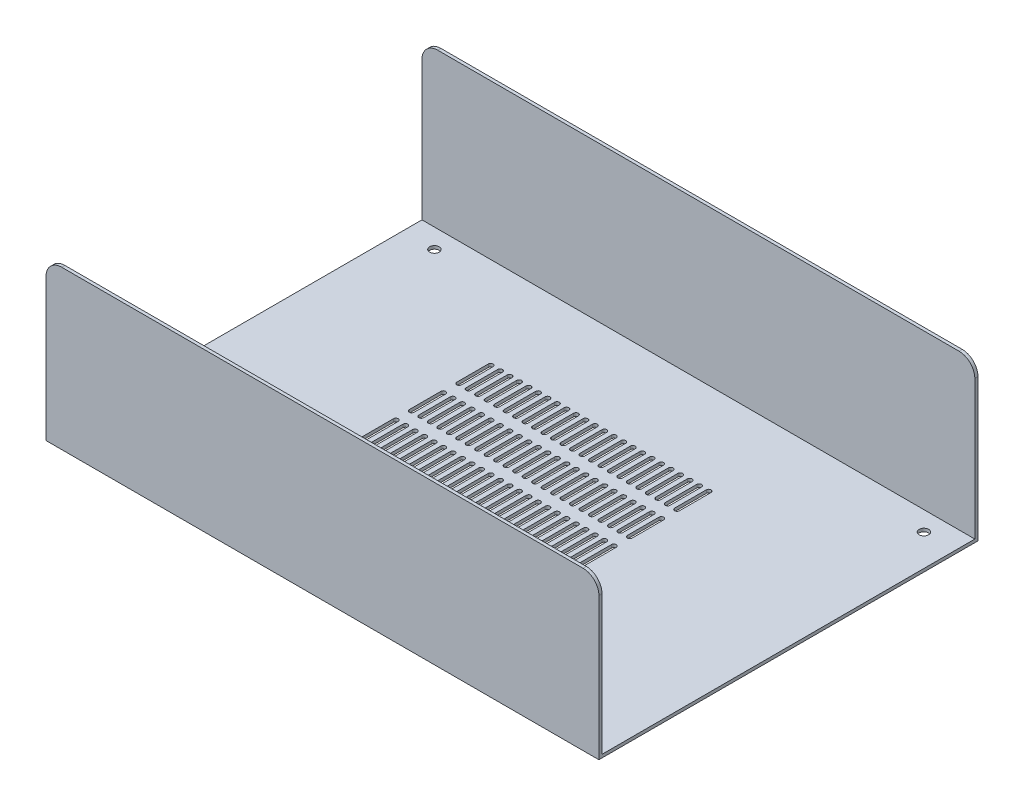
from build123d import *

# Parameters (mm, degrees)
SKETCH1_W          = 175
SKETCH1_H          = 120
EXTRUDE1_DEPTH     = 1
EXTRUDE2_DEPTH     = 1
SKETCH3_R          = 1.5
CUT_EXTRUDE1_DEPTH = 118.287041057
EXTRUDE3_DEPTH     = 1


with BuildPart() as part:
    # Sketch1 → Extrude1 (new body)
    with BuildSketch(Plane(origin=(0, 0, 0), x_dir=(1, 0, 0), z_dir=(0, 1, 0))):
        Rectangle(SKETCH1_W, SKETCH1_H)
    extrude(amount=EXTRUDE1_DEPTH)

    # Sketch2 → Extrude2 (add)
    with BuildSketch(Plane.XY.offset(60)):
        with BuildLine():
            Line((-82.5, 50), (82.5, 50))
            ThreePointArc((82.5, 50), (86.035533906, 48.535533906), (87.5, 45))
            Line((87.5, 45), (87.5, 1))
            Line((87.5, 1), (-87.5, 1))
            Line((-87.5, 1), (-87.5, 45))
            ThreePointArc((-87.5, 45), (-86.035533906, 48.535533906), (-82.5, 50))
        make_face()
    extrude2 = extrude(amount=-EXTRUDE2_DEPTH)

    # Mirror1: Extrude2 across plane
    add(extrude2.mirror(Plane.XY))

    # Sketch3 → Cut-Extrude1 (cut, through all)
    with BuildSketch(Plane.XZ):
        with Locations(Location((-77.42, 51.92, 0), (0, 0, 270))):
            Circle(SKETCH3_R)
        with Locations(Location((77.52, 51.92, 0), (0, 0, 270))):
            Circle(SKETCH3_R)
        with Locations(Location((77.52, -52.86, 0), (0, 0, 270))):
            Circle(SKETCH3_R)
        with Locations(Location((-77.42, -52.86, 0), (0, 0, 270))):
            Circle(SKETCH3_R)
    extrude(amount=-CUT_EXTRUDE1_DEPTH, mode=Mode.SUBTRACT)

    # Sketch4 → Extrude3 (cut)
    with BuildSketch(Plane.XZ):
        with BuildLine():
            Line((-37.5, 10), (-37.5, 0))
            ThreePointArc((-37.5, 0), (-36.75, -0.75), (-36, 0))
            Line((-36, 0), (-36, 10))
            ThreePointArc((-36, 10), (-36.75, 10.75), (-37.5, 10))
        make_face()
        with BuildLine():
            Line((-34.5, 10), (-34.5, 0))
            ThreePointArc((-34.5, 0), (-33.75, -0.75), (-33, 0))
            Line((-33, 0), (-33, 10))
            ThreePointArc((-33, 10), (-33.75, 10.75), (-34.5, 10))
        make_face()
        with BuildLine():
            Line((-31.5, 10), (-31.5, 0))
            ThreePointArc((-31.5, 0), (-30.75, -0.75), (-30, 0))
            Line((-30, 0), (-30, 10))
            ThreePointArc((-30, 10), (-30.75, 10.75), (-31.5, 10))
        make_face()
        with BuildLine():
            Line((-28.5, 10), (-28.5, 0))
            ThreePointArc((-28.5, 0), (-27.75, -0.75), (-27, 0))
            Line((-27, 0), (-27, 10))
            ThreePointArc((-27, 10), (-27.75, 10.75), (-28.5, 10))
        make_face()
        with BuildLine():
            Line((-25.5, 10), (-25.5, 0))
            ThreePointArc((-25.5, 0), (-24.75, -0.75), (-24, 0))
            Line((-24, 0), (-24, 10))
            ThreePointArc((-24, 10), (-24.75, 10.75), (-25.5, 10))
        make_face()
        with BuildLine():
            Line((-22.5, 10), (-22.5, 0))
            ThreePointArc((-22.5, 0), (-21.75, -0.75), (-21, 0))
            Line((-21, 0), (-21, 10))
            ThreePointArc((-21, 10), (-21.75, 10.75), (-22.5, 10))
        make_face()
        with BuildLine():
            Line((-19.5, 10), (-19.5, 0))
            ThreePointArc((-19.5, 0), (-18.75, -0.75), (-18, 0))
            Line((-18, 0), (-18, 10))
            ThreePointArc((-18, 10), (-18.75, 10.75), (-19.5, 10))
        make_face()
        with BuildLine():
            Line((-16.5, 10), (-16.5, 0))
            ThreePointArc((-16.5, 0), (-15.75, -0.75), (-15, 0))
            Line((-15, 0), (-15, 10))
            ThreePointArc((-15, 10), (-15.75, 10.75), (-16.5, 10))
        make_face()
        with BuildLine():
            Line((-13.5, 10), (-13.5, 0))
            ThreePointArc((-13.5, 0), (-12.75, -0.75), (-12, 0))
            Line((-12, 0), (-12, 10))
            ThreePointArc((-12, 10), (-12.75, 10.75), (-13.5, 10))
        make_face()
        with BuildLine():
            Line((-10.5, 10), (-10.5, 0))
            ThreePointArc((-10.5, 0), (-9.75, -0.75), (-9, 0))
            Line((-9, 0), (-9, 10))
            ThreePointArc((-9, 10), (-9.75, 10.75), (-10.5, 10))
        make_face()
        with BuildLine():
            Line((-7.5, 10), (-7.5, 0))
            ThreePointArc((-7.5, 0), (-6.75, -0.75), (-6, 0))
            Line((-6, 0), (-6, 10))
            ThreePointArc((-6, 10), (-6.75, 10.75), (-7.5, 10))
        make_face()
        with BuildLine():
            Line((-4.5, 10), (-4.5, 0))
            ThreePointArc((-4.5, 0), (-3.75, -0.75), (-3, 0))
            Line((-3, 0), (-3, 10))
            ThreePointArc((-3, 10), (-3.75, 10.75), (-4.5, 10))
        make_face()
        with BuildLine():
            Line((-1.5, 10), (-1.5, 0))
            ThreePointArc((-1.5, 0), (-0.75, -0.75), (0, 0))
            Line((0, 0), (0, 10))
            ThreePointArc((0, 10), (-0.75, 10.75), (-1.5, 10))
        make_face()
        with BuildLine():
            Line((1.5, 10), (1.5, 0))
            ThreePointArc((1.5, 0), (2.25, -0.75), (3, 0))
            Line((3, 0), (3, 10))
            ThreePointArc((3, 10), (2.25, 10.75), (1.5, 10))
        make_face()
        with BuildLine():
            Line((4.5, 10), (4.5, 0))
            ThreePointArc((4.5, 0), (5.25, -0.75), (6, 0))
            Line((6, 0), (6, 10))
            ThreePointArc((6, 10), (5.25, 10.75), (4.5, 10))
        make_face()
        with BuildLine():
            Line((7.5, 10), (7.5, 0))
            ThreePointArc((7.5, 0), (8.25, -0.75), (9, 0))
            Line((9, 0), (9, 10))
            ThreePointArc((9, 10), (8.25, 10.75), (7.5, 10))
        make_face()
        with BuildLine():
            Line((10.5, 10), (10.5, 0))
            ThreePointArc((10.5, 0), (11.25, -0.75), (12, 0))
            Line((12, 0), (12, 10))
            ThreePointArc((12, 10), (11.25, 10.75), (10.5, 10))
        make_face()
        with BuildLine():
            Line((13.5, 10), (13.5, 0))
            ThreePointArc((13.5, 0), (14.25, -0.75), (15, 0))
            Line((15, 0), (15, 10))
            ThreePointArc((15, 10), (14.25, 10.75), (13.5, 10))
        make_face()
        with BuildLine():
            Line((16.5, 10), (16.5, 0))
            ThreePointArc((16.5, 0), (17.25, -0.75), (18, 0))
            Line((18, 0), (18, 10))
            ThreePointArc((18, 10), (17.25, 10.75), (16.5, 10))
        make_face()
        with BuildLine():
            Line((19.5, 10), (19.5, 0))
            ThreePointArc((19.5, 0), (20.25, -0.75), (21, 0))
            Line((21, 0), (21, 10))
            ThreePointArc((21, 10), (20.25, 10.75), (19.5, 10))
        make_face()
        with BuildLine():
            Line((22.5, 10), (22.5, 0))
            ThreePointArc((22.5, 0), (23.25, -0.75), (24, 0))
            Line((24, 0), (24, 10))
            ThreePointArc((24, 10), (23.25, 10.75), (22.5, 10))
        make_face()
        with BuildLine():
            Line((25.5, 10), (25.5, 0))
            ThreePointArc((25.5, 0), (26.25, -0.75), (27, 0))
            Line((27, 0), (27, 10))
            ThreePointArc((27, 10), (26.25, 10.75), (25.5, 10))
        make_face()
        with BuildLine():
            Line((28.5, 10), (28.5, 0))
            ThreePointArc((28.5, 0), (29.25, -0.75), (30, 0))
            Line((30, 0), (30, 10))
            ThreePointArc((30, 10), (29.25, 10.75), (28.5, 10))
        make_face()
        with BuildLine():
            Line((31.5, 10), (31.5, 0))
            ThreePointArc((31.5, 0), (32.25, -0.75), (33, 0))
            Line((33, 0), (33, 10))
            ThreePointArc((33, 10), (32.25, 10.75), (31.5, 10))
        make_face()
        with BuildLine():
            Line((-37.5, -5), (-37.5, -15))
            ThreePointArc((-37.5, -15), (-36.75, -15.75), (-36, -15))
            Line((-36, -15), (-36, -5))
            ThreePointArc((-36, -5), (-36.75, -4.25), (-37.5, -5))
        make_face()
        with BuildLine():
            Line((-34.5, -5), (-34.5, -15))
            ThreePointArc((-34.5, -15), (-33.75, -15.75), (-33, -15))
            Line((-33, -15), (-33, -5))
            ThreePointArc((-33, -5), (-33.75, -4.25), (-34.5, -5))
        make_face()
        with BuildLine():
            Line((-31.5, -5), (-31.5, -15))
            ThreePointArc((-31.5, -15), (-30.75, -15.75), (-30, -15))
            Line((-30, -15), (-30, -5))
            ThreePointArc((-30, -5), (-30.75, -4.25), (-31.5, -5))
        make_face()
        with BuildLine():
            Line((-28.5, -5), (-28.5, -15))
            ThreePointArc((-28.5, -15), (-27.75, -15.75), (-27, -15))
            Line((-27, -15), (-27, -5))
            ThreePointArc((-27, -5), (-27.75, -4.25), (-28.5, -5))
        make_face()
        with BuildLine():
            Line((-25.5, -5), (-25.5, -15))
            ThreePointArc((-25.5, -15), (-24.75, -15.75), (-24, -15))
            Line((-24, -15), (-24, -5))
            ThreePointArc((-24, -5), (-24.75, -4.25), (-25.5, -5))
        make_face()
        with BuildLine():
            Line((-22.5, -5), (-22.5, -15))
            ThreePointArc((-22.5, -15), (-21.75, -15.75), (-21, -15))
            Line((-21, -15), (-21, -5))
            ThreePointArc((-21, -5), (-21.75, -4.25), (-22.5, -5))
        make_face()
        with BuildLine():
            Line((-19.5, -5), (-19.5, -15))
            ThreePointArc((-19.5, -15), (-18.75, -15.75), (-18, -15))
            Line((-18, -15), (-18, -5))
            ThreePointArc((-18, -5), (-18.75, -4.25), (-19.5, -5))
        make_face()
        with BuildLine():
            Line((-16.5, -5), (-16.5, -15))
            ThreePointArc((-16.5, -15), (-15.75, -15.75), (-15, -15))
            Line((-15, -15), (-15, -5))
            ThreePointArc((-15, -5), (-15.75, -4.25), (-16.5, -5))
        make_face()
        with BuildLine():
            Line((-13.5, -5), (-13.5, -15))
            ThreePointArc((-13.5, -15), (-12.75, -15.75), (-12, -15))
            Line((-12, -15), (-12, -5))
            ThreePointArc((-12, -5), (-12.75, -4.25), (-13.5, -5))
        make_face()
        with BuildLine():
            Line((-10.5, -5), (-10.5, -15))
            ThreePointArc((-10.5, -15), (-9.75, -15.75), (-9, -15))
            Line((-9, -15), (-9, -5))
            ThreePointArc((-9, -5), (-9.75, -4.25), (-10.5, -5))
        make_face()
        with BuildLine():
            Line((-7.5, -5), (-7.5, -15))
            ThreePointArc((-7.5, -15), (-6.75, -15.75), (-6, -15))
            Line((-6, -15), (-6, -5))
            ThreePointArc((-6, -5), (-6.75, -4.25), (-7.5, -5))
        make_face()
        with BuildLine():
            Line((-4.5, -5), (-4.5, -15))
            ThreePointArc((-4.5, -15), (-3.75, -15.75), (-3, -15))
            Line((-3, -15), (-3, -5))
            ThreePointArc((-3, -5), (-3.75, -4.25), (-4.5, -5))
        make_face()
        with BuildLine():
            Line((-1.5, -5), (-1.5, -15))
            ThreePointArc((-1.5, -15), (-0.75, -15.75), (0, -15))
            Line((0, -15), (0, -5))
            ThreePointArc((0, -5), (-0.75, -4.25), (-1.5, -5))
        make_face()
        with BuildLine():
            Line((1.5, -5), (1.5, -15))
            ThreePointArc((1.5, -15), (2.25, -15.75), (3, -15))
            Line((3, -15), (3, -5))
            ThreePointArc((3, -5), (2.25, -4.25), (1.5, -5))
        make_face()
        with BuildLine():
            Line((4.5, -5), (4.5, -15))
            ThreePointArc((4.5, -15), (5.25, -15.75), (6, -15))
            Line((6, -15), (6, -5))
            ThreePointArc((6, -5), (5.25, -4.25), (4.5, -5))
        make_face()
        with BuildLine():
            Line((7.5, -5), (7.5, -15))
            ThreePointArc((7.5, -15), (8.25, -15.75), (9, -15))
            Line((9, -15), (9, -5))
            ThreePointArc((9, -5), (8.25, -4.25), (7.5, -5))
        make_face()
        with BuildLine():
            Line((10.5, -5), (10.5, -15))
            ThreePointArc((10.5, -15), (11.25, -15.75), (12, -15))
            Line((12, -15), (12, -5))
            ThreePointArc((12, -5), (11.25, -4.25), (10.5, -5))
        make_face()
        with BuildLine():
            Line((13.5, -5), (13.5, -15))
            ThreePointArc((13.5, -15), (14.25, -15.75), (15, -15))
            Line((15, -15), (15, -5))
            ThreePointArc((15, -5), (14.25, -4.25), (13.5, -5))
        make_face()
        with BuildLine():
            Line((16.5, -5), (16.5, -15))
            ThreePointArc((16.5, -15), (17.25, -15.75), (18, -15))
            Line((18, -15), (18, -5))
            ThreePointArc((18, -5), (17.25, -4.25), (16.5, -5))
        make_face()
        with BuildLine():
            Line((19.5, -5), (19.5, -15))
            ThreePointArc((19.5, -15), (20.25, -15.75), (21, -15))
            Line((21, -15), (21, -5))
            ThreePointArc((21, -5), (20.25, -4.25), (19.5, -5))
        make_face()
        with BuildLine():
            Line((22.5, -5), (22.5, -15))
            ThreePointArc((22.5, -15), (23.25, -15.75), (24, -15))
            Line((24, -15), (24, -5))
            ThreePointArc((24, -5), (23.25, -4.25), (22.5, -5))
        make_face()
        with BuildLine():
            Line((25.5, -5), (25.5, -15))
            ThreePointArc((25.5, -15), (26.25, -15.75), (27, -15))
            Line((27, -15), (27, -5))
            ThreePointArc((27, -5), (26.25, -4.25), (25.5, -5))
        make_face()
        with BuildLine():
            Line((28.5, -5), (28.5, -15))
            ThreePointArc((28.5, -15), (29.25, -15.75), (30, -15))
            Line((30, -15), (30, -5))
            ThreePointArc((30, -5), (29.25, -4.25), (28.5, -5))
        make_face()
        with BuildLine():
            Line((31.5, -5), (31.5, -15))
            ThreePointArc((31.5, -15), (32.25, -15.75), (33, -15))
            Line((33, -15), (33, -5))
            ThreePointArc((33, -5), (32.25, -4.25), (31.5, -5))
        make_face()
        with BuildLine():
            Line((-37.5, -20), (-37.5, -30))
            ThreePointArc((-37.5, -30), (-36.75, -30.75), (-36, -30))
            Line((-36, -30), (-36, -20))
            ThreePointArc((-36, -20), (-36.75, -19.25), (-37.5, -20))
        make_face()
        with BuildLine():
            Line((-34.5, -20), (-34.5, -30))
            ThreePointArc((-34.5, -30), (-33.75, -30.75), (-33, -30))
            Line((-33, -30), (-33, -20))
            ThreePointArc((-33, -20), (-33.75, -19.25), (-34.5, -20))
        make_face()
        with BuildLine():
            Line((-31.5, -20), (-31.5, -30))
            ThreePointArc((-31.5, -30), (-30.75, -30.75), (-30, -30))
            Line((-30, -30), (-30, -20))
            ThreePointArc((-30, -20), (-30.75, -19.25), (-31.5, -20))
        make_face()
        with BuildLine():
            Line((-28.5, -20), (-28.5, -30))
            ThreePointArc((-28.5, -30), (-27.75, -30.75), (-27, -30))
            Line((-27, -30), (-27, -20))
            ThreePointArc((-27, -20), (-27.75, -19.25), (-28.5, -20))
        make_face()
        with BuildLine():
            Line((-25.5, -20), (-25.5, -30))
            ThreePointArc((-25.5, -30), (-24.75, -30.75), (-24, -30))
            Line((-24, -30), (-24, -20))
            ThreePointArc((-24, -20), (-24.75, -19.25), (-25.5, -20))
        make_face()
        with BuildLine():
            Line((-22.5, -20), (-22.5, -30))
            ThreePointArc((-22.5, -30), (-21.75, -30.75), (-21, -30))
            Line((-21, -30), (-21, -20))
            ThreePointArc((-21, -20), (-21.75, -19.25), (-22.5, -20))
        make_face()
        with BuildLine():
            Line((-19.5, -20), (-19.5, -30))
            ThreePointArc((-19.5, -30), (-18.75, -30.75), (-18, -30))
            Line((-18, -30), (-18, -20))
            ThreePointArc((-18, -20), (-18.75, -19.25), (-19.5, -20))
        make_face()
        with BuildLine():
            Line((-16.5, -20), (-16.5, -30))
            ThreePointArc((-16.5, -30), (-15.75, -30.75), (-15, -30))
            Line((-15, -30), (-15, -20))
            ThreePointArc((-15, -20), (-15.75, -19.25), (-16.5, -20))
        make_face()
        with BuildLine():
            Line((-13.5, -20), (-13.5, -30))
            ThreePointArc((-13.5, -30), (-12.75, -30.75), (-12, -30))
            Line((-12, -30), (-12, -20))
            ThreePointArc((-12, -20), (-12.75, -19.25), (-13.5, -20))
        make_face()
        with BuildLine():
            Line((-10.5, -20), (-10.5, -30))
            ThreePointArc((-10.5, -30), (-9.75, -30.75), (-9, -30))
            Line((-9, -30), (-9, -20))
            ThreePointArc((-9, -20), (-9.75, -19.25), (-10.5, -20))
        make_face()
        with BuildLine():
            Line((-7.5, -20), (-7.5, -30))
            ThreePointArc((-7.5, -30), (-6.75, -30.75), (-6, -30))
            Line((-6, -30), (-6, -20))
            ThreePointArc((-6, -20), (-6.75, -19.25), (-7.5, -20))
        make_face()
        with BuildLine():
            Line((-4.5, -20), (-4.5, -30))
            ThreePointArc((-4.5, -30), (-3.75, -30.75), (-3, -30))
            Line((-3, -30), (-3, -20))
            ThreePointArc((-3, -20), (-3.75, -19.25), (-4.5, -20))
        make_face()
        with BuildLine():
            Line((-1.5, -20), (-1.5, -30))
            ThreePointArc((-1.5, -30), (-0.75, -30.75), (0, -30))
            Line((0, -30), (0, -20))
            ThreePointArc((0, -20), (-0.75, -19.25), (-1.5, -20))
        make_face()
        with BuildLine():
            Line((1.5, -20), (1.5, -30))
            ThreePointArc((1.5, -30), (2.25, -30.75), (3, -30))
            Line((3, -30), (3, -20))
            ThreePointArc((3, -20), (2.25, -19.25), (1.5, -20))
        make_face()
        with BuildLine():
            Line((4.5, -20), (4.5, -30))
            ThreePointArc((4.5, -30), (5.25, -30.75), (6, -30))
            Line((6, -30), (6, -20))
            ThreePointArc((6, -20), (5.25, -19.25), (4.5, -20))
        make_face()
        with BuildLine():
            Line((7.5, -20), (7.5, -30))
            ThreePointArc((7.5, -30), (8.25, -30.75), (9, -30))
            Line((9, -30), (9, -20))
            ThreePointArc((9, -20), (8.25, -19.25), (7.5, -20))
        make_face()
        with BuildLine():
            Line((10.5, -20), (10.5, -30))
            ThreePointArc((10.5, -30), (11.25, -30.75), (12, -30))
            Line((12, -30), (12, -20))
            ThreePointArc((12, -20), (11.25, -19.25), (10.5, -20))
        make_face()
        with BuildLine():
            Line((13.5, -20), (13.5, -30))
            ThreePointArc((13.5, -30), (14.25, -30.75), (15, -30))
            Line((15, -30), (15, -20))
            ThreePointArc((15, -20), (14.25, -19.25), (13.5, -20))
        make_face()
        with BuildLine():
            Line((16.5, -20), (16.5, -30))
            ThreePointArc((16.5, -30), (17.25, -30.75), (18, -30))
            Line((18, -30), (18, -20))
            ThreePointArc((18, -20), (17.25, -19.25), (16.5, -20))
        make_face()
        with BuildLine():
            Line((19.5, -20), (19.5, -30))
            ThreePointArc((19.5, -30), (20.25, -30.75), (21, -30))
            Line((21, -30), (21, -20))
            ThreePointArc((21, -20), (20.25, -19.25), (19.5, -20))
        make_face()
        with BuildLine():
            Line((22.5, -20), (22.5, -30))
            ThreePointArc((22.5, -30), (23.25, -30.75), (24, -30))
            Line((24, -30), (24, -20))
            ThreePointArc((24, -20), (23.25, -19.25), (22.5, -20))
        make_face()
        with BuildLine():
            Line((25.5, -20), (25.5, -30))
            ThreePointArc((25.5, -30), (26.25, -30.75), (27, -30))
            Line((27, -30), (27, -20))
            ThreePointArc((27, -20), (26.25, -19.25), (25.5, -20))
        make_face()
        with BuildLine():
            Line((28.5, -20), (28.5, -30))
            ThreePointArc((28.5, -30), (29.25, -30.75), (30, -30))
            Line((30, -30), (30, -20))
            ThreePointArc((30, -20), (29.25, -19.25), (28.5, -20))
        make_face()
        with BuildLine():
            Line((31.5, -20), (31.5, -30))
            ThreePointArc((31.5, -30), (32.25, -30.75), (33, -30))
            Line((33, -30), (33, -20))
            ThreePointArc((33, -20), (32.25, -19.25), (31.5, -20))
        make_face()
    extrude(amount=-EXTRUDE3_DEPTH, mode=Mode.SUBTRACT)


solid = part.part
